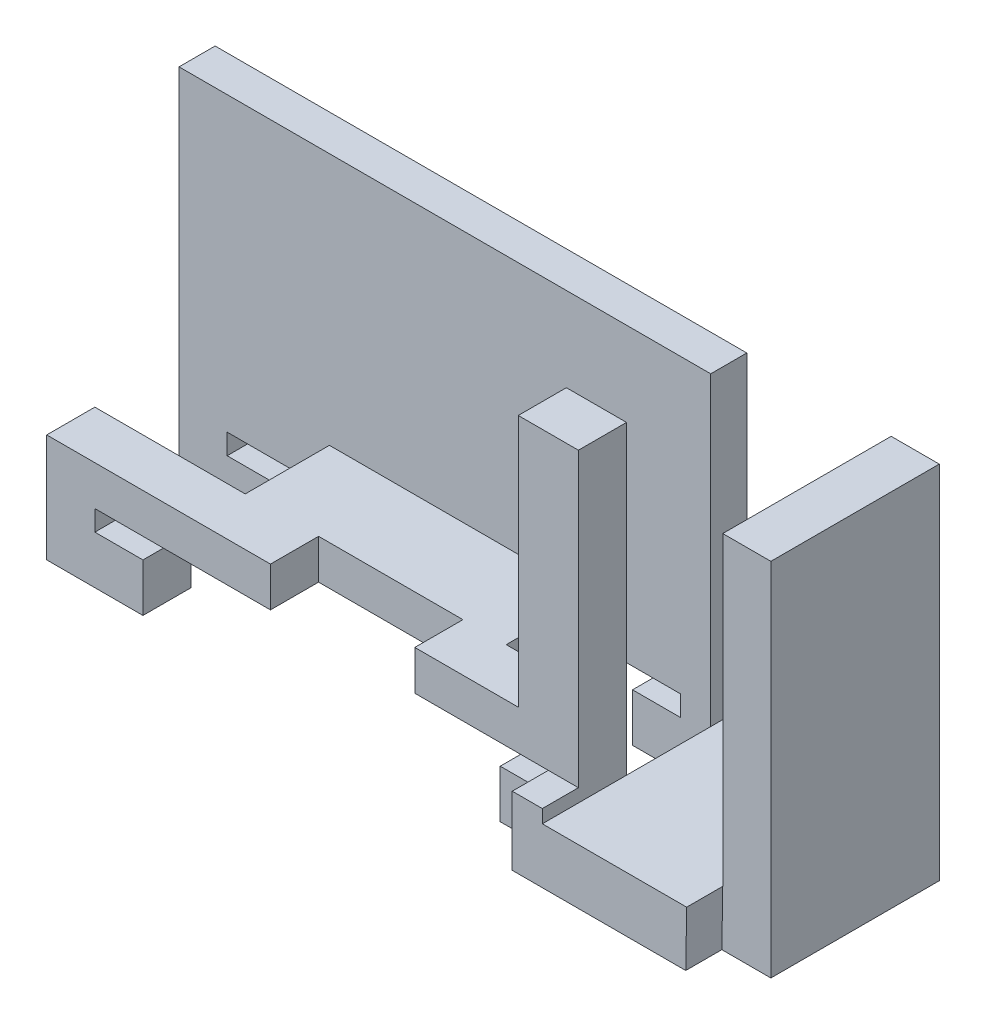
from build123d import *

# Parameters (mm, degrees)
CROQUIS1_W              = 60.2
CROQUIS1_H              = 14
SALIENTE_EXTRUIR1_DEPTH = 30
CROQUIS2_W              = 12
CROQUIS2_H              = 25.4
CORTAR_EXTRUIR1_DEPTH   = 14
CORTAR_EXTRUIR2_START   = -30
CROQUIS3_W              = 12.5
CROQUIS3_H              = 7
CROQUIS3_W_2            = 10
CORTAR_EXTRUIR2_DEPTH   = 30
CORTAR_EXTRUIR3_DEPTH   = 21
CROQUIS5_W              = 12
CROQUIS5_H              = 4
CORTAR_EXTRUIR4_DEPTH   = 3.3
SALIENTE_EXTRUIR2_DEPTH = 3
SALIENTE_EXTRUIR3_DEPTH = 3


with BuildPart() as part:
    # Croquis1 → Saliente-Extruir1 (new body)
    with BuildSketch(Plane(origin=(0, 0, 0), x_dir=(1, 0, 0), z_dir=(0, 1, 0))):
        with Locations((-26.023666378, 13.176470588)):
            Rectangle(CROQUIS1_W, CROQUIS1_H)
    extrude(amount=SALIENTE_EXTRUIR1_DEPTH)

    # Croquis2 → Cortar-Extruir1 (cut)
    with BuildSketch(Plane.XY.offset(-6.176470588)):
        Polygon((-48.123666378, 0), (-18.423666378, 0), (-18.423666378, 4), (-14.423666378, 4), (-14.423666378, 5.7), (-19.023666378, 5.7), (-50.023666378, 5.7), (-52.123666378, 5.7), (-52.123666378, 4), (-48.123666378, 4), align=None)
        with Locations((-5.923666378, 17.3)):
            Rectangle(CROQUIS2_W, CROQUIS2_H)
    extrude(amount=-CORTAR_EXTRUIR1_DEPTH, mode=Mode.SUBTRACT)

    # Croquis3 → Cortar-Extruir2 (cut)
    with BuildSketch(Plane(origin=(0, 30, 0), x_dir=(1, 0, 0), z_dir=(0, 1, 0)).offset(CORTAR_EXTRUIR2_START)):
        with Locations((-49.873666378, 13.676470588)):
            Rectangle(CROQUIS3_W, CROQUIS3_H)
        with Locations((-16.923666378, 13.676470588)):
            Rectangle(CROQUIS3_W_2, CROQUIS3_H)
    extrude(amount=CORTAR_EXTRUIR2_DEPTH, mode=Mode.SUBTRACT)

    # Croquis4 → Cortar-Extruir3 (cut)
    with BuildSketch(Plane(origin=(0, 30, 0), x_dir=(1, 0, 0), z_dir=(0, 1, 0))):
        Polygon((-43.623666378, 17.176470588), (-21.923666378, 17.176470588), (-21.923666378, 10.176470588), (-16.923666378, 10.176470588), (-16.923666378, 6.176470588), (-56.123666378, 6.176470588), (-56.123666378, 10.176470588), (-43.623666378, 10.176470588), align=None)
    extrude(amount=-CORTAR_EXTRUIR3_DEPTH, mode=Mode.SUBTRACT)

    # Croquis5 → Cortar-Extruir4 (cut)
    with BuildSketch(Plane(origin=(0, 9, 0), x_dir=(1, 0, 0), z_dir=(0, 1, 0))):
        with Locations((-31.523666378, 8.176470588)):
            Rectangle(CROQUIS5_W, CROQUIS5_H)
    extrude(amount=-CORTAR_EXTRUIR4_DEPTH, mode=Mode.SUBTRACT)

    # Croquis6 → Saliente-Extruir2 (add)
    with BuildSketch(Plane.XY.offset(-6.176470588)):
        Polygon((-14.423666378, 5.7), (-11.923666378, 5.7), (-11.923666378, 4.6), (0.076333622, 4.6), (0, 0), (-14.423666378, 0), align=None)
    extrude(amount=SALIENTE_EXTRUIR2_DEPTH)

    # Croquis7 → Saliente-Extruir3 (add)
    with BuildSketch(Plane(origin=(0, 0, -20.176470588), x_dir=(-1, 0, 0), z_dir=(0, 0, -1))):
        Polygon((14.423666378, 5.7), (11.923666378, 5.7), (11.923666378, 4.6), (-0.076333622, 4.6), (0, 0), (14.423666378, 0), align=None)
    extrude(amount=SALIENTE_EXTRUIR3_DEPTH)


solid = part.part
